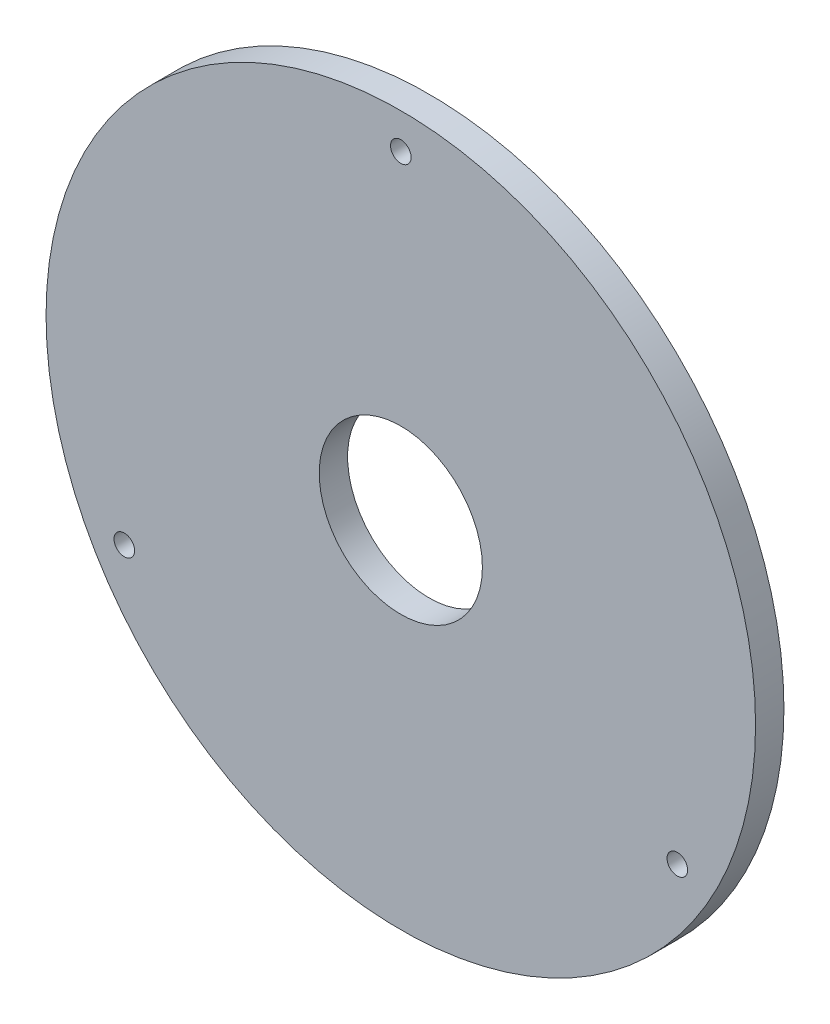
from build123d import *

# Parameters (mm, degrees)
SKETCH1_R           = 50
SKETCH1_R_2         = 11.5
SKETCH1_R_3         = 1.45
BOSS_EXTRUDE1_DEPTH = 4


with BuildPart() as part:
    # Sketch1 → Boss-Extrude1 (new body)
    with BuildSketch(Plane.XY):
        Circle(SKETCH1_R)
        Circle(SKETCH1_R_2, mode=Mode.SUBTRACT)
        with Locations((0, 45)):
            Circle(SKETCH1_R_3, mode=Mode.SUBTRACT)
        with Locations((38.97114317, -22.5)):
            Circle(SKETCH1_R_3, mode=Mode.SUBTRACT)
        with Locations((-38.97114317, -22.5)):
            Circle(SKETCH1_R_3, mode=Mode.SUBTRACT)
    extrude(amount=BOSS_EXTRUDE1_DEPTH)


solid = part.part
